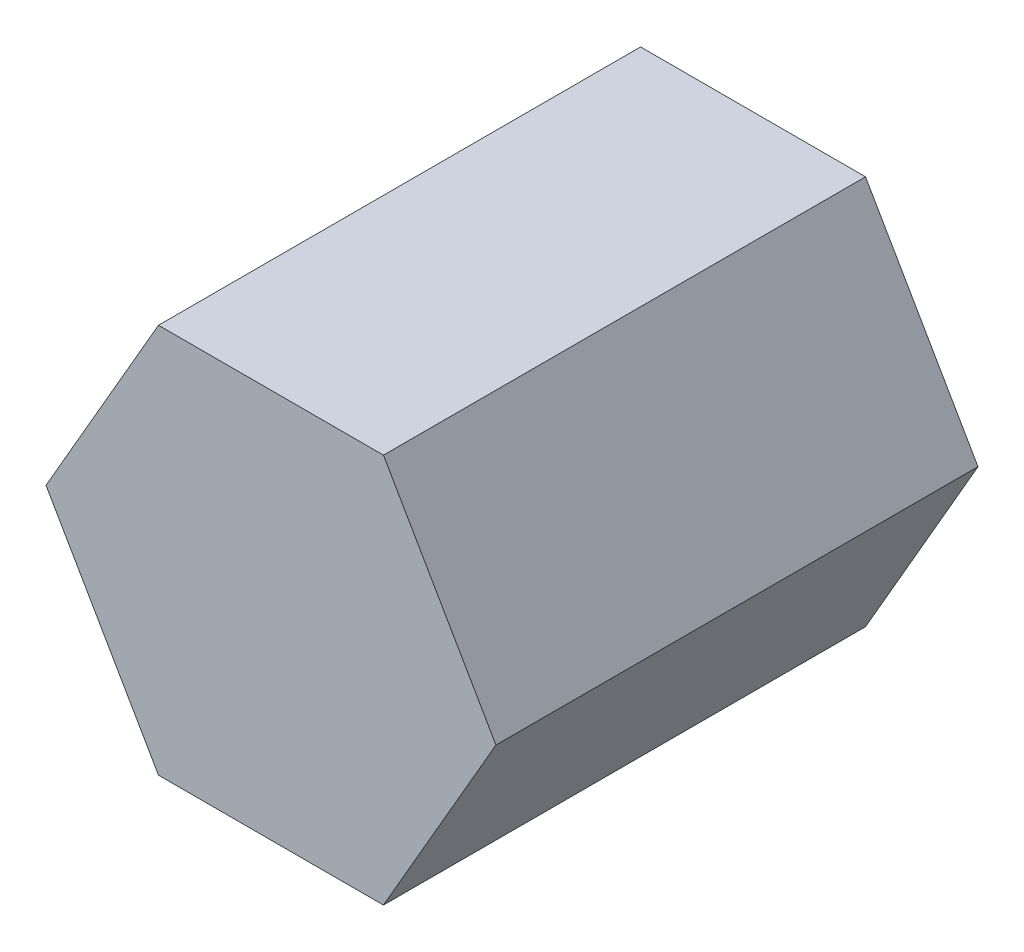
from build123d import *

# Parameters (mm, degrees)
PRISM_DEPTH = 60


with BuildPart() as part:
    # Sketch1 → Prism (new body)
    with BuildSketch(Plane.XY):
        Polygon((28, 0), (14, 24.248711306), (-14, 24.248711306), (-28, 0), (-14, -24.248711306), (14, -24.248711306), align=None)
    extrude(amount=PRISM_DEPTH)


solid = part.part
